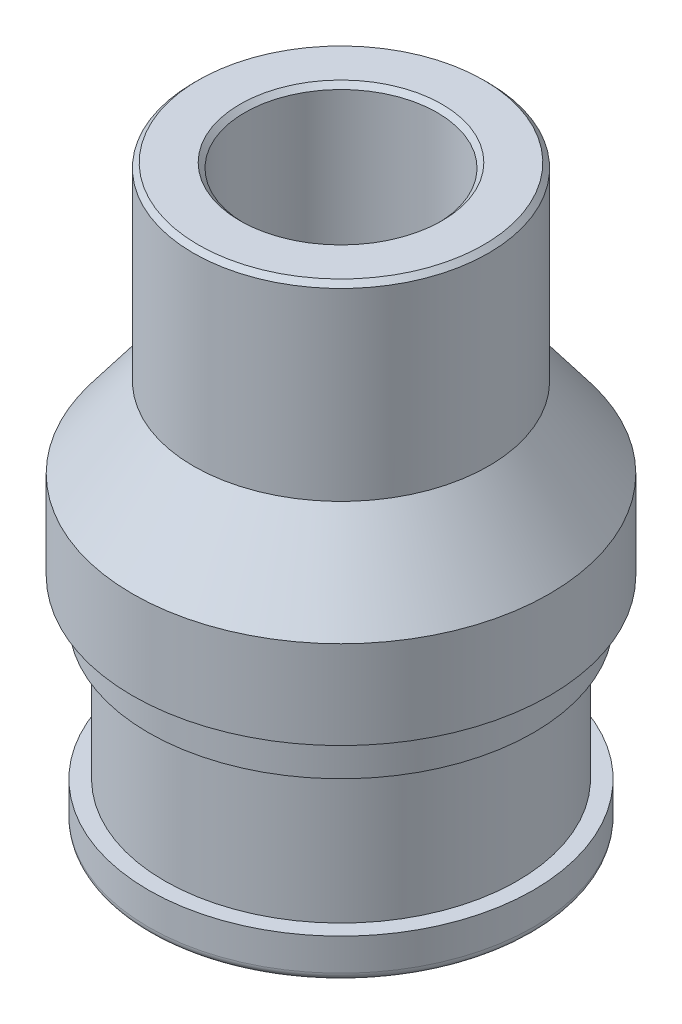
from build123d import *

# Parameters (mm, degrees)
SKETCH1_R           = 4.6
SKETCH1_R_2         = 3
BOSS_EXTRUDE1_DEPTH = 5.9
CHAMFER1_SIZE       = 0.15
CHAMFER2_SIZE       = 0.15
SKETCH2_R           = 4.6
BOSS_EXTRUDE2_DEPTH = 2.5
BOSS_EXTRUDE2_DRAFT = -37.234833982
SKETCH3_R           = 3
CUT_EXTRUDE1_DEPTH  = 2.5
SKETCH4_R           = 6.5
SKETCH4_R_2         = 3
BOSS_EXTRUDE3_DEPTH = 4
SKETCH5_R           = 5.5
SKETCH5_R_2         = 3
BOSS_EXTRUDE4_DEPTH = 5.5
CUT_EXTRUDE2_START  = -1.25
SKETCH6_R           = 6.5
SKETCH6_R_2         = 6
CUT_EXTRUDE2_DEPTH  = 1.25
BOSS_EXTRUDE5_START = -1.25
SKETCH7_R           = 6
SKETCH7_R_2         = 5.5
BOSS_EXTRUDE5_DEPTH = 1.25
FILLET1_R           = 0.25
SKETCH8_R           = 4.5
CUT_EXTRUDE3_DEPTH  = 4
CHAMFER4_SIZE       = 0.15
CHAMFER5_SIZE       = 0.15


with BuildPart() as part:
    # Sketch1 → Boss-Extrude1 (new body)
    with BuildSketch(Plane(origin=(0, 1, 0), x_dir=(-1, 0, 0), z_dir=(0, -1, 0))):
        with Locations(Location((-12.350088109, 22.338562584, 0), (0, 0, 90))):
            Circle(SKETCH1_R)
        with Locations(Location((-12.350088109, 22.338562584, 0), (0, 0, 90))):
            Circle(SKETCH1_R_2, mode=Mode.SUBTRACT)
    extrude(amount=BOSS_EXTRUDE1_DEPTH)

    # Chamfer1
    chamfer1_edges = [part.edges().sort_by_distance(p)[0] for p in [
        (12.350088109, 1, -17.738562584),
    ]]
    chamfer(chamfer1_edges, length=CHAMFER1_SIZE)

    # Chamfer2
    chamfer2_edges = [part.edges().sort_by_distance(p)[0] for p in [
        (12.350088109, 1, -19.338562584),
    ]]
    chamfer(chamfer2_edges, length=CHAMFER2_SIZE)


with BuildPart() as boss_extrude2_tool:
    # Sketch2 → Boss-Extrude2 (with draft: the straight prism first)
    with BuildSketch(Plane(origin=(0, -4.9, 0), x_dir=(-1, 0, 0), z_dir=(0, -1, 0))):
        with Locations(Location((-12.350088109, 22.338562584, 0), (0, 0, 90))):
            Circle(SKETCH2_R)
    extrude(amount=BOSS_EXTRUDE2_DEPTH)
    # Boss-Extrude2: the draft: its side faces are tilted about the plane it starts from
    boss_extrude2_sides = [boss_extrude2_tool.faces().sort_by_distance(p)[0] for p in [
        (12.350088109, -6.15, -17.738562584),
    ]]
    draft(boss_extrude2_sides, Plane(origin=(0, -4.9, 0), x_dir=(-1, 0, 0), z_dir=(0, -1, 0)), BOSS_EXTRUDE2_DRAFT)


with BuildPart() as part_1:
    add(part.part)

    # Boss-Extrude2: add boss_extrude2_tool
    add(boss_extrude2_tool.part)

    # Sketch3 → Cut-Extrude1 (cut)
    with BuildSketch(Plane(origin=(0, -4.9, 0), x_dir=(1, 0, 0), z_dir=(0, 1, 0))):
        with Locations(Location((12.350088109, 22.338562584, 0), (0, 0, 270))):
            Circle(SKETCH3_R)
    extrude(amount=-CUT_EXTRUDE1_DEPTH, mode=Mode.SUBTRACT)

    # Sketch4 → Boss-Extrude3 (add)
    with BuildSketch(Plane(origin=(0, -7.4, 0), x_dir=(-1, 0, 0), z_dir=(0, -1, 0))):
        with Locations(Location((-12.350088109, 22.338562584, 0), (0, 0, 90))):
            Circle(SKETCH4_R)
        with Locations(Location((-12.350088109, 22.338562584, 0), (0, 0, 270))):
            Circle(SKETCH4_R_2, mode=Mode.SUBTRACT)
    extrude(amount=BOSS_EXTRUDE3_DEPTH)

    # Sketch5 → Boss-Extrude4 (add)
    with BuildSketch(Plane.XZ.offset(11.4)):
        with Locations(Location((12.350088109, -22.338562584, 0), (0, 0, 270))):
            Circle(SKETCH5_R)
        with Locations(Location((12.350088109, -22.338562584, 0), (0, 0, 90))):
            Circle(SKETCH5_R_2, mode=Mode.SUBTRACT)
    extrude(amount=BOSS_EXTRUDE4_DEPTH)

    # Sketch6 → Cut-Extrude2 (cut)
    with BuildSketch(Plane.XZ.offset(11.4).offset(CUT_EXTRUDE2_START)):
        with Locations(Location((12.350088109, -22.338562584, 0), (0, 0, 270))):
            Circle(SKETCH6_R)
        with Locations(Location((12.350088109, -22.338562584, 0), (0, 0, 270))):
            Circle(SKETCH6_R_2, mode=Mode.SUBTRACT)
    extrude(amount=CUT_EXTRUDE2_DEPTH, mode=Mode.SUBTRACT)

    # Sketch7 → Boss-Extrude5 (add)
    with BuildSketch(Plane(origin=(0, -16.9, 0), x_dir=(-1, 0, 0), z_dir=(0, -1, 0)).offset(BOSS_EXTRUDE5_START)):
        with Locations(Location((-12.350088109, 22.338562584, 0), (0, 0, 90))):
            Circle(SKETCH7_R)
        with Locations(Location((-12.350088109, 22.338562584, 0), (0, 0, 90))):
            Circle(SKETCH7_R_2, mode=Mode.SUBTRACT)
    extrude(amount=BOSS_EXTRUDE5_DEPTH)

    # Fillet1
    fillet1_edges = [part_1.edges().sort_by_distance(p)[0] for p in [
        (12.350088109, -16.9, -16.338562584),
    ]]
    fillet(fillet1_edges, radius=FILLET1_R)

    # Sketch8 → Cut-Extrude3 (cut)
    with BuildSketch(Plane(origin=(0, -16.9, 0), x_dir=(-1, 0, 0), z_dir=(0, -1, 0))):
        with Locations(Location((-12.350088109, 22.338562584, 0), (0, 0, 90))):
            Circle(SKETCH8_R)
    extrude(amount=-CUT_EXTRUDE3_DEPTH, mode=Mode.SUBTRACT)

    # Chamfer4
    chamfer4_edges = [part_1.edges().sort_by_distance(p)[0] for p in [
        (12.350088109, -16.9, -17.838562584),
    ]]
    chamfer(chamfer4_edges, length=CHAMFER4_SIZE)

    # Chamfer5
    chamfer5_edges = [part_1.edges().sort_by_distance(p)[0] for p in [
        (12.350088109, -12.9, -25.338562584),
    ]]
    chamfer(chamfer5_edges, length=CHAMFER5_SIZE)


solid = part_1.part
